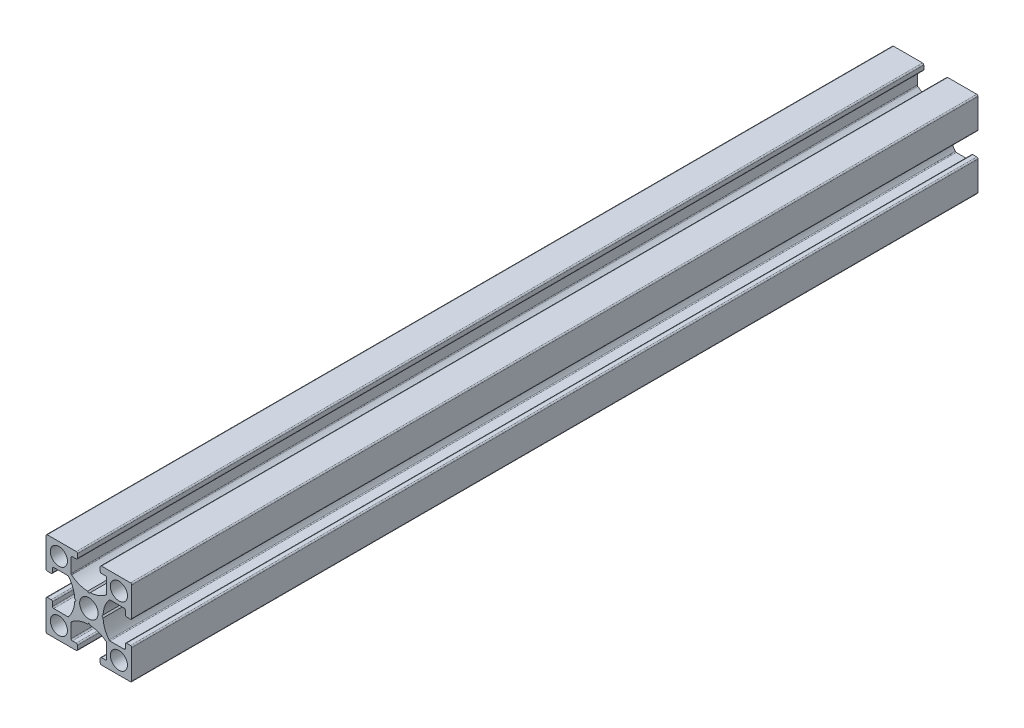
from build123d import *

# Parameters (mm, degrees)
MODEL_R             = 2.15
MODEL_R_2           = 2
EXTRUDE_1_DEPTH     = 197.38
SKETCH_2_R          = 2.5
CUT_EXTRUDE_3_DEPTH = 1214.518219112


with BuildPart() as part:
    # Model → 보스-돌출1 (new body)
    with BuildSketch(Plane.XY):
        with BuildLine():
            Line((2307.763927197, 1192.134297913), (2307.763927197, 1195.391548465))
            ThreePointArc((2307.763927197, 1195.391548465), (2307.676059232, 1195.603680499), (2307.463927197, 1195.691548465))
            Line((2307.463927197, 1195.691548465), (2306.563927197, 1195.691548465))
            ThreePointArc((2306.563927197, 1195.691548465), (2306.351795163, 1195.779416431), (2306.263927197, 1195.991548465))
            Line((2306.263927197, 1195.991548465), (2306.263927197, 1196.891548465))
            ThreePointArc((2306.263927197, 1196.891548465), (2306.351795163, 1197.103680499), (2306.563927197, 1197.191548465))
            Line((2306.563927197, 1197.191548465), (2313.313927197, 1197.191548465))
            ThreePointArc((2313.313927197, 1197.191548465), (2313.526059232, 1197.103680499), (2313.613927197, 1196.891548465))
            Line((2313.613927197, 1196.891548465), (2313.613927197, 1190.141548465))
            ThreePointArc((2313.613927197, 1190.141548465), (2313.526059232, 1189.929416431), (2313.313927197, 1189.841548465))
            Line((2313.313927197, 1189.841548465), (2312.413927197, 1189.841548465))
            ThreePointArc((2312.413927197, 1189.841548465), (2312.201795163, 1189.929416431), (2312.113927197, 1190.141548465))
            Line((2312.113927197, 1190.141548465), (2312.113927197, 1191.041548465))
            ThreePointArc((2312.113927197, 1191.041548465), (2312.026059232, 1191.253680499), (2311.813927197, 1191.341548465))
            Line((2311.813927197, 1191.341548465), (2308.556676645, 1191.341548465))
            ThreePointArc((2308.556676645, 1191.341548465), (2308.426234796, 1191.311705686), (2308.321744595, 1191.228114625))
            ThreePointArc((2308.321744595, 1191.228114625), (2307.328306374, 1189.47356999), (2306.921204563, 1187.498825831))
            Line((2306.921204563, 1187.498825831), (2306.613927197, 1187.191548465))
            Line((2306.613927197, 1187.191548465), (2306.921204563, 1186.884271099))
            ThreePointArc((2306.921204563, 1186.884271099), (2307.328306374, 1184.90952694), (2308.321744595, 1183.154982305))
            ThreePointArc((2308.321744595, 1183.154982305), (2308.426234796, 1183.071391244), (2308.556676645, 1183.041548465))
            Line((2308.556676645, 1183.041548465), (2311.813927197, 1183.041548465))
            ThreePointArc((2311.813927197, 1183.041548465), (2312.026059232, 1183.129416431), (2312.113927197, 1183.341548465))
            Line((2312.113927197, 1183.341548465), (2312.113927197, 1184.241548465))
            ThreePointArc((2312.113927197, 1184.241548465), (2312.201795163, 1184.453680499), (2312.413927197, 1184.541548465))
            Line((2312.413927197, 1184.541548465), (2313.313927197, 1184.541548465))
            ThreePointArc((2313.313927197, 1184.541548465), (2313.526059232, 1184.453680499), (2313.613927197, 1184.241548465))
            Line((2313.613927197, 1184.241548465), (2313.613927197, 1177.491548465))
            ThreePointArc((2313.613927197, 1177.491548465), (2313.526059232, 1177.279416431), (2313.313927197, 1177.191548465))
            Line((2313.313927197, 1177.191548465), (2306.563927197, 1177.191548465))
            ThreePointArc((2306.563927197, 1177.191548465), (2306.351795163, 1177.279416431), (2306.263927197, 1177.491548465))
            Line((2306.263927197, 1177.491548465), (2306.263927197, 1178.391548465))
            ThreePointArc((2306.263927197, 1178.391548465), (2306.351795163, 1178.603680499), (2306.563927197, 1178.691548465))
            Line((2306.563927197, 1178.691548465), (2307.463927197, 1178.691548465))
            ThreePointArc((2307.463927197, 1178.691548465), (2307.676059232, 1178.779416431), (2307.763927197, 1178.991548465))
            Line((2307.763927197, 1178.991548465), (2307.763927197, 1182.248799017))
            ThreePointArc((2307.763927197, 1182.248799017), (2307.734084418, 1182.379240866), (2307.650493357, 1182.483731067))
            ThreePointArc((2307.650493357, 1182.483731067), (2305.895948722, 1183.477169289), (2303.921204563, 1183.884271099))
            Line((2303.921204563, 1183.884271099), (2303.613927197, 1184.191548465))
            Line((2303.613927197, 1184.191548465), (2303.306649831, 1183.884271099))
            ThreePointArc((2303.306649831, 1183.884271099), (2301.331905673, 1183.477169289), (2299.577361038, 1182.483731067))
            ThreePointArc((2299.577361038, 1182.483731067), (2299.493769977, 1182.379240866), (2299.463927197, 1182.248799017))
            Line((2299.463927197, 1182.248799017), (2299.463927197, 1178.991548465))
            ThreePointArc((2299.463927197, 1178.991548465), (2299.551795163, 1178.779416431), (2299.763927197, 1178.691548465))
            Line((2299.763927197, 1178.691548465), (2300.663927197, 1178.691548465))
            ThreePointArc((2300.663927197, 1178.691548465), (2300.876059232, 1178.603680499), (2300.963927197, 1178.391548465))
            Line((2300.963927197, 1178.391548465), (2300.963927197, 1177.491548465))
            ThreePointArc((2300.963927197, 1177.491548465), (2300.876059232, 1177.279416431), (2300.663927197, 1177.191548465))
            Line((2300.663927197, 1177.191548465), (2293.913927197, 1177.191548465))
            ThreePointArc((2293.913927197, 1177.191548465), (2293.701795163, 1177.279416431), (2293.613927197, 1177.491548465))
            Line((2293.613927197, 1177.491548465), (2293.613927197, 1184.241548465))
            ThreePointArc((2293.613927197, 1184.241548465), (2293.701795163, 1184.453680499), (2293.913927197, 1184.541548465))
            Line((2293.913927197, 1184.541548465), (2294.813927197, 1184.541548465))
            ThreePointArc((2294.813927197, 1184.541548465), (2295.026059232, 1184.453680499), (2295.113927197, 1184.241548465))
            Line((2295.113927197, 1184.241548465), (2295.113927197, 1183.341548465))
            ThreePointArc((2295.113927197, 1183.341548465), (2295.201795163, 1183.129416431), (2295.413927197, 1183.041548465))
            Line((2295.413927197, 1183.041548465), (2298.671177749, 1183.041548465))
            ThreePointArc((2298.671177749, 1183.041548465), (2298.801619599, 1183.071391244), (2298.906109799, 1183.154982305))
            ThreePointArc((2298.906109799, 1183.154982305), (2299.899548021, 1184.90952694), (2300.306649831, 1186.884271099))
            Line((2300.306649831, 1186.884271099), (2300.613927197, 1187.191548465))
            Line((2300.613927197, 1187.191548465), (2300.306649831, 1187.498825831))
            ThreePointArc((2300.306649831, 1187.498825831), (2299.899548021, 1189.47356999), (2298.906109799, 1191.228114625))
            ThreePointArc((2298.906109799, 1191.228114625), (2298.801619599, 1191.311705686), (2298.671177749, 1191.341548465))
            Line((2298.671177749, 1191.341548465), (2295.413927197, 1191.341548465))
            ThreePointArc((2295.413927197, 1191.341548465), (2295.201795163, 1191.253680499), (2295.113927197, 1191.041548465))
            Line((2295.113927197, 1191.041548465), (2295.113927197, 1190.141548465))
            ThreePointArc((2295.113927197, 1190.141548465), (2295.026059232, 1189.929416431), (2294.813927197, 1189.841548465))
            Line((2294.813927197, 1189.841548465), (2293.913927197, 1189.841548465))
            ThreePointArc((2293.913927197, 1189.841548465), (2293.701795163, 1189.929416431), (2293.613927197, 1190.141548465))
            Line((2293.613927197, 1190.141548465), (2293.613927197, 1196.891548465))
            ThreePointArc((2293.613927197, 1196.891548465), (2293.701795163, 1197.103680499), (2293.913927197, 1197.191548465))
            Line((2293.913927197, 1197.191548465), (2300.663927197, 1197.191548465))
            ThreePointArc((2300.663927197, 1197.191548465), (2300.876059232, 1197.103680499), (2300.963927197, 1196.891548465))
            Line((2300.963927197, 1196.891548465), (2300.963927197, 1195.991548465))
            ThreePointArc((2300.963927197, 1195.991548465), (2300.876059232, 1195.779416431), (2300.663927197, 1195.691548465))
            Line((2300.663927197, 1195.691548465), (2299.763927197, 1195.691548465))
            ThreePointArc((2299.763927197, 1195.691548465), (2299.551795163, 1195.603680499), (2299.463927197, 1195.391548465))
            Line((2299.463927197, 1195.391548465), (2299.463927197, 1192.134297913))
            ThreePointArc((2299.463927197, 1192.134297913), (2299.493769977, 1192.003856063), (2299.577361038, 1191.899365863))
            ThreePointArc((2299.577361038, 1191.899365863), (2301.331905673, 1190.905927641), (2303.306649831, 1190.498825831))
            Line((2303.306649831, 1190.498825831), (2303.613927197, 1190.191548465))
            Line((2303.613927197, 1190.191548465), (2303.921204563, 1190.498825831))
            ThreePointArc((2303.921204563, 1190.498825831), (2305.895948722, 1190.905927641), (2307.650493357, 1191.899365863))
            ThreePointArc((2307.650493357, 1191.899365863), (2307.734084418, 1192.003856063), (2307.763927197, 1192.134297913))
        make_face()
        with Locations((2303.613927197, 1187.191548465)):
            Circle(MODEL_R, mode=Mode.SUBTRACT)
        with Locations((2296.613927197, 1194.191548465)):
            Circle(MODEL_R_2, mode=Mode.SUBTRACT)
        with Locations((2296.613927197, 1180.191548465)):
            Circle(MODEL_R_2, mode=Mode.SUBTRACT)
        with Locations((2310.613927197, 1194.191548465)):
            Circle(MODEL_R_2, mode=Mode.SUBTRACT)
        with Locations((2310.613927197, 1180.191548465)):
            Circle(MODEL_R_2, mode=Mode.SUBTRACT)
    extrude(amount=EXTRUDE_1_DEPTH)

    # 스케치2 → 컷-돌출3 (cut, through all)
    with BuildSketch(Plane(origin=(2313.613927197, 0, 0), x_dir=(0, 0, -1), z_dir=(1, 0, 0))):
        with Locations((-9.99943331, 1187.191548465)):
            Circle(SKETCH_2_R)
        with Locations((-177.38, 1187.191548465)):
            Circle(SKETCH_2_R)
    extrude(amount=-CUT_EXTRUDE_3_DEPTH, mode=Mode.SUBTRACT)


solid = part.part
